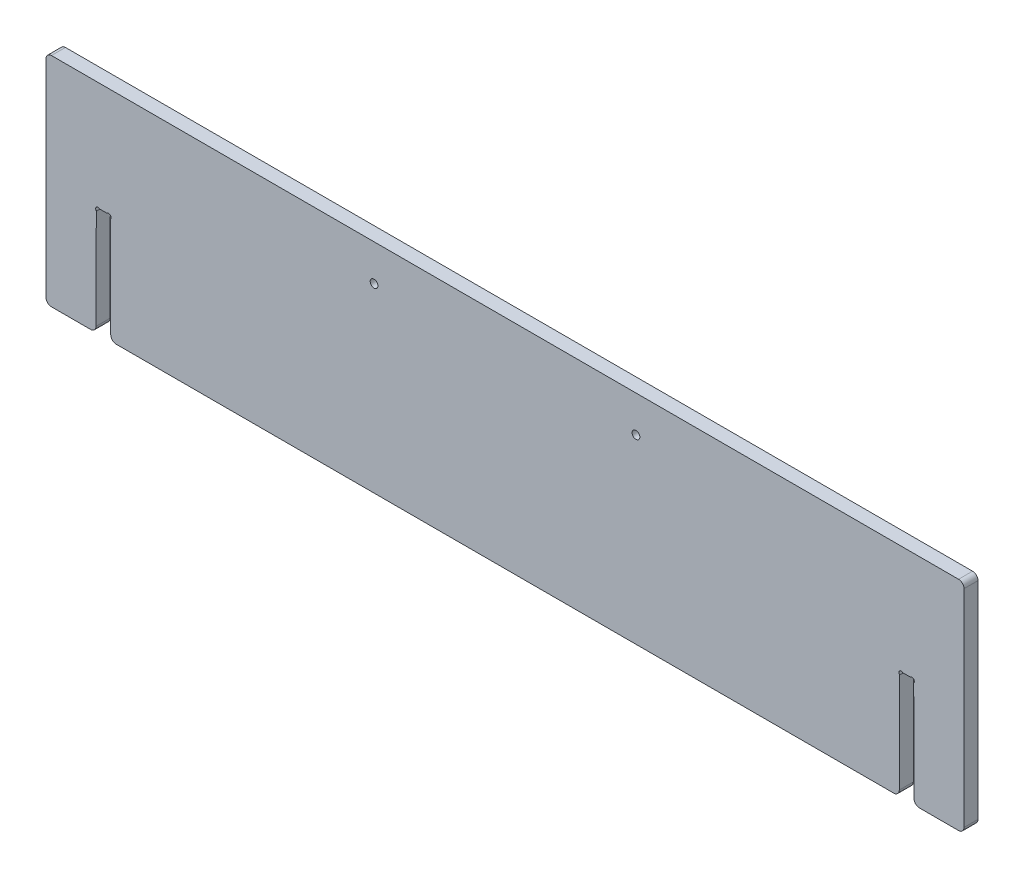
from build123d import *

# Parameters (mm, degrees)
ESQUISSE1_W         = 590.5
ESQUISSE1_H         = 280
BOSS_EXTRUDE1_DEPTH = 18
CUT_EXTRUDE1_DEPTH  = 654.769263579
ESQUISSE3_R         = 5
CUT_EXTRUDE2_DEPTH  = 654.769263579
CONG_1_R            = 7


with BuildPart() as part:
    # Esquisse1 → Boss-Extrude1 (new body)
    with BuildSketch(Plane.XY):
        with Locations((295.25, 140)):
            Rectangle(ESQUISSE1_W, ESQUISSE1_H)
    extrude(amount=BOSS_EXTRUDE1_DEPTH)

    # Esquisse2 → Cut-Extrude1 (cut, through all)
    with BuildSketch(Plane.XY.offset(18)):
        with BuildLine():
            Line((69.477649355, 140), (78.147350645, 140))
            ThreePointArc((78.147350645, 140), (78.480108702, 140.056987765), (78.774940482, 140.221455848))
            ThreePointArc((78.774940482, 140.221455848), (82.906692971, 140.005791686), (83.14421642, 135.875238181))
            ThreePointArc((83.14421642, 135.875238181), (82.981710298, 135.580689894), (82.926074516, 135.248919502))
            Line((82.926074516, 135.248919502), (83.3125, 0))
            Line((83.3125, 0), (64.3125, 0))
            Line((64.3125, 0), (64.698925484, 135.248919502))
            ThreePointArc((64.698925484, 135.248919502), (64.643289702, 135.580689894), (64.48078358, 135.875238181))
            ThreePointArc((64.48078358, 135.875238181), (64.718307029, 140.005791686), (68.850059518, 140.221455848))
            ThreePointArc((68.850059518, 140.221455848), (69.144891298, 140.056987765), (69.477649355, 140))
        make_face()
    extrude(amount=-CUT_EXTRUDE1_DEPTH, mode=Mode.SUBTRACT)

    # Esquisse3 → Cut-Extrude2 (cut, through all)
    with BuildSketch(Plane.XY.offset(18)):
        with Locations((422.0625, 233.333333333)):
            Circle(ESQUISSE3_R)
    extrude(amount=-CUT_EXTRUDE2_DEPTH, mode=Mode.SUBTRACT)

    # Congé1
    cong_1_edges = [part.edges().sort_by_distance(p)[0] for p in [
        (83.3125, 0, 9),
        (64.3125, 0, 9),
        (0, 0, 9),
        (0, 280, 9),
    ]]
    fillet(cong_1_edges, radius=CONG_1_R)

    # Symétrie1: part across plane


with BuildPart() as part_1:
    add(part.part)
    add(part.part.mirror(Plane(origin=(590.5, 0, 18), x_dir=(0, 0, 1), z_dir=(-1, 0, 0))))


solid = part_1.part
